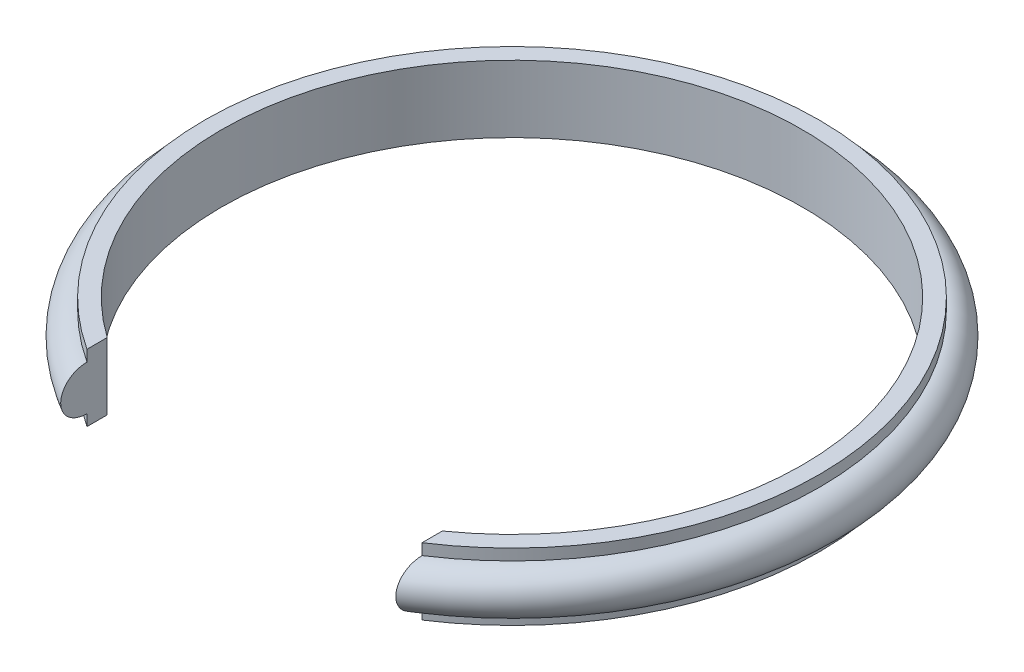
from build123d import *

# Parameters (mm, degrees)
SKETCH3_W          = 30
SKETCH3_H          = 6
CUT_EXTRUDE1_DEPTH = 42.827024898


with BuildPart() as part:
    # Sketch1 → Revolve1 (revolve)
    with BuildSketch(Plane.XY, mode=Mode.PRIVATE) as revolve1_sk:
        with BuildLine():
            Line((-26, -3), (-26, 3))
            Line((-26, 3), (-27.5, 3))
            Line((-27.5, 3), (-27.5, 2))
            ThreePointArc((-27.5, 2), (-29.5, 0), (-27.5, -2))
            Line((-27.5, -2), (-27.5, -3))
            Line((-27.5, -3), (-26, -3))
        make_face()
    revolve(revolve1_sk.sketch.rotate(Axis((0, 27.580200319, 0), (0, -1, 0)), 270), axis=Axis((0, 27.580200319, 0), (0, -1, 0)))

    # Sketch3 → Cut-Extrude1 (cut, through all)
    with BuildSketch(Plane.XY):
        Rectangle(SKETCH3_W, SKETCH3_H)
    extrude(amount=CUT_EXTRUDE1_DEPTH, mode=Mode.SUBTRACT)


solid = part.part
